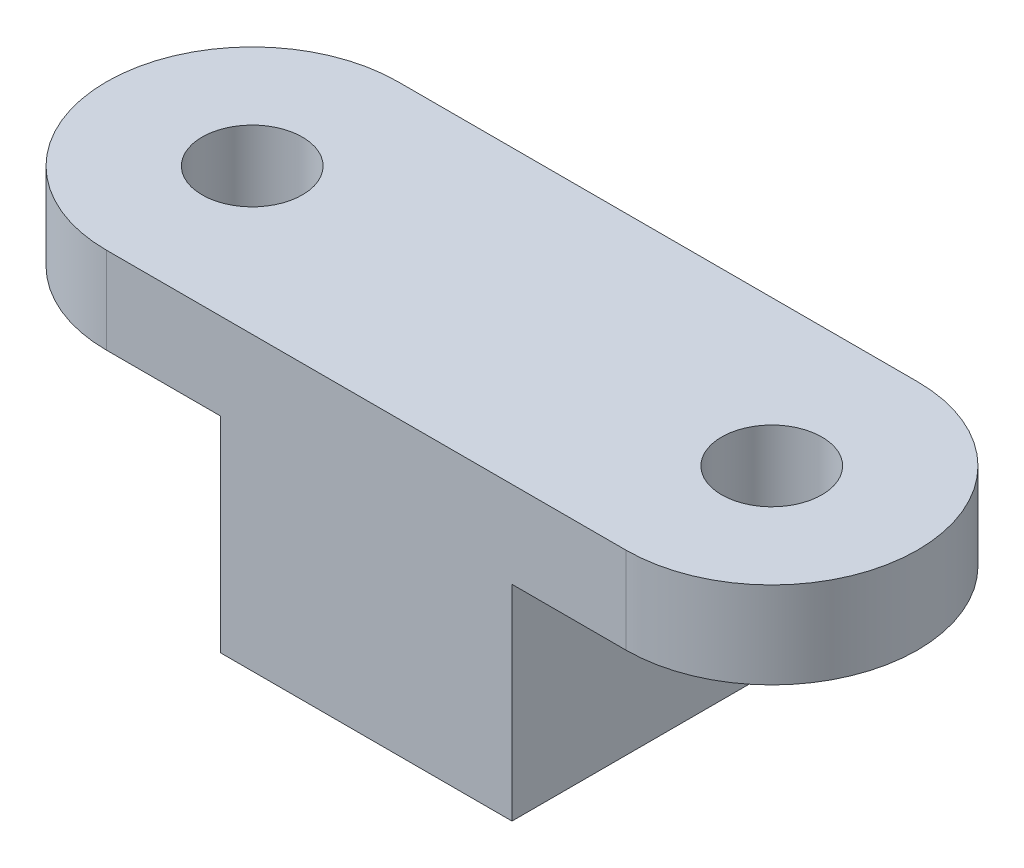
from build123d import *

# Parameters (mm, degrees)
SKETCH1_R           = 11
BOSS_EXTRUDE1_DEPTH = 19
SKETCH3_W           = 32
SKETCH3_H           = 64
BOSS_EXTRUDE2_DEPTH = 45
CUT_EXTRUDE1_DEPTH  = 19


with BuildPart() as part:
    # Sketch1 → Boss-Extrude1 (new body)
    with BuildSketch(Plane(origin=(0, 0, 0), x_dir=(1, 0, 0), z_dir=(0, 1, 0))):
        with BuildLine():
            Line((0, 32), (114, 32))
            ThreePointArc((114, 32), (146, 0), (114, -32))
            Line((114, -32), (0, -32))
            ThreePointArc((0, -32), (-32, 0), (0, 32))
        make_face()
        with Locations(Location((0, 0, 0), (0, 0, 270))):
            Circle(SKETCH1_R, mode=Mode.SUBTRACT)
        with Locations(Location((114, 0, 0), (0, 0, 270))):
            Circle(SKETCH1_R, mode=Mode.SUBTRACT)
    extrude(amount=BOSS_EXTRUDE1_DEPTH)

    # Sketch3 → Boss-Extrude2 (add)
    with BuildSketch(Plane.XZ):
        with Locations((41, 0)):
            Rectangle(SKETCH3_W, SKETCH3_H)
    boss_extrude2 = extrude(amount=BOSS_EXTRUDE2_DEPTH)

    # Sketch4 → Cut-Extrude1 (cut)
    with BuildSketch(Plane(origin=(57, 0, 0), x_dir=(0, 0, -1), z_dir=(1, 0, 0))):
        Polygon((32, -45), (-19, -45), (32, 6), align=None)
    cut_extrude1 = extrude(amount=-CUT_EXTRUDE1_DEPTH, mode=Mode.SUBTRACT)

    # Mirror1: Boss-Extrude2, Cut-Extrude1 across plane
    add(boss_extrude2.mirror(Plane(origin=(57, 0, 0), x_dir=(0, 0, 1), z_dir=(1, 0, 0))))
    add(cut_extrude1.mirror(Plane(origin=(57, 0, 0), x_dir=(0, 0, 1), z_dir=(1, 0, 0))), mode=Mode.SUBTRACT)


solid = part.part
